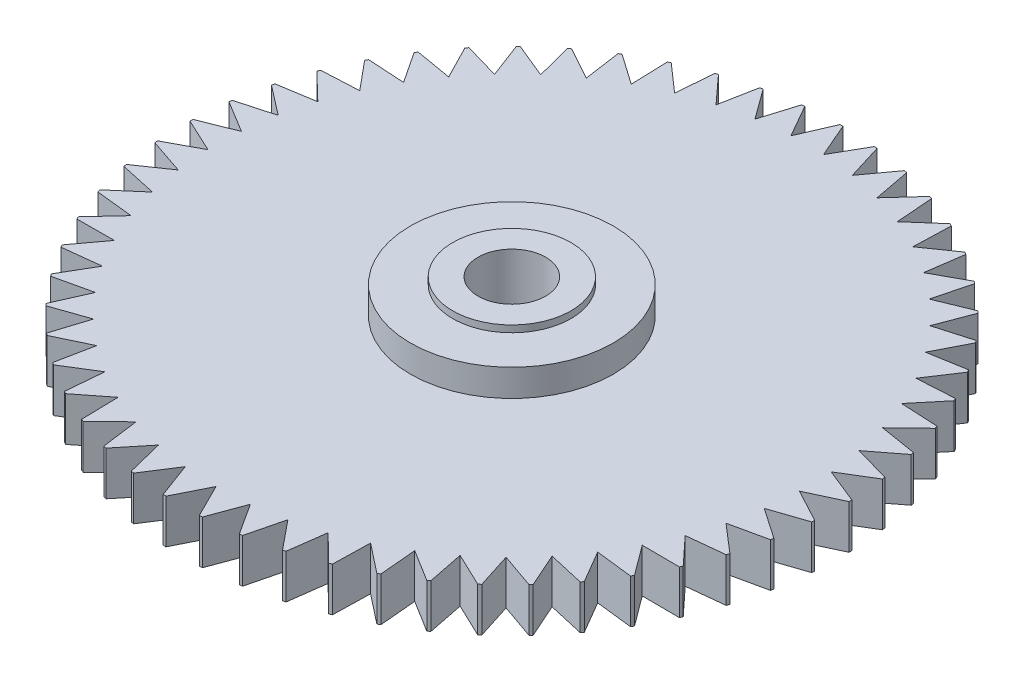
from build123d import *

# Parameters (mm, degrees)
ENL_V_MAT_EXTRU_1_DEPTH      = 29.714108031
R_P_TITION_CIRCULAIRE1_COUNT = 57


with BuildPart() as part:
    # Esquisse1 → Révolution1 (revolve)
    with BuildSketch(Plane.XY, mode=Mode.PRIVATE) as r_volution1_sk:
        Polygon((2, 0), (2, 12.6), (3.5, 12.6), (3.5, 6.4), (4.75, 6.4), (4.75, 0), align=None)
    revolve(r_volution1_sk.sketch.rotate(Axis((0, 0, 0), (0, 1, 0)), 90), axis=Axis((0, 0, 0), (0, 1, 0)))


with BuildPart() as body_2:
    # Esquisse2 → Révolution2 (revolve)
    with BuildSketch(Plane.XY, mode=Mode.PRIVATE) as r_volution2_sk:
        Polygon((3.5, 6.4), (6, 6.4), (6, 8), (19.5, 8), (19.5, 10.6), (6, 10.6), (6, 12.2), (3.5, 12.2), align=None)
    revolve(r_volution2_sk.sketch.rotate(Axis((0, 12.6, 0), (0, -1, 0)), 90), axis=Axis((0, 12.6, 0), (0, -1, 0)))

    # Esquisse3 → Enlèv. mat.-Extru.1 (cut, through all)
    with BuildSketch(Plane.XZ.offset(-8)):
        Polygon((-1, 19.5), (1, 19.5), (0, 17.5), align=None)
    enl_v_mat_extru_1 = extrude(amount=-ENL_V_MAT_EXTRU_1_DEPTH, mode=Mode.SUBTRACT)

    # Répétition circulaire1: Enlèv. mat.-Extru.1 ×57 about axis
    r_p_tition_circulaire1_axis = Axis((0, 0, 0), (0, 1, 0))
    for i in range(1, R_P_TITION_CIRCULAIRE1_COUNT):
        add(enl_v_mat_extru_1.rotate(r_p_tition_circulaire1_axis, i * 360 / R_P_TITION_CIRCULAIRE1_COUNT), mode=Mode.SUBTRACT)


solid = Compound([part.part, body_2.part])
